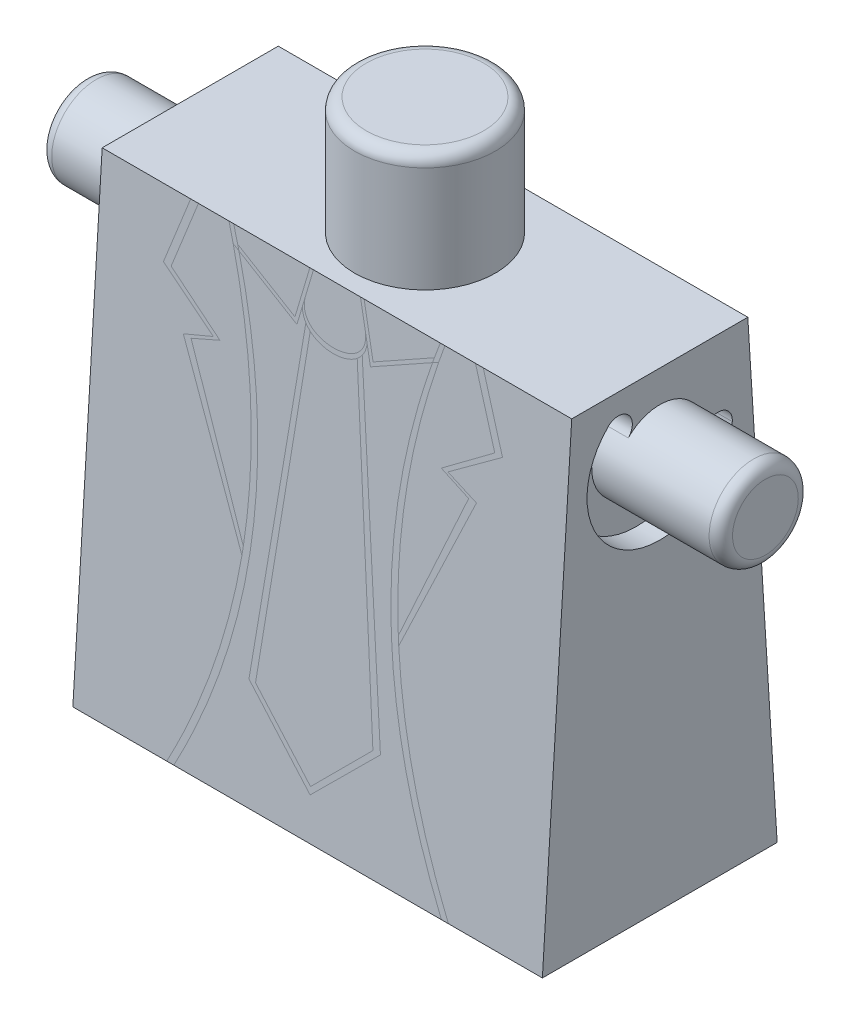
from build123d import *
from build123d.topology import SkipClean

# Parameters (mm, degrees)
SKETCH13_R                                  = 3
HEAD_PIN_DEPTH                              = 5
SKETCH2_W                                   = 6
SKETCH2_H                                   = 6
HIP_HOLE_PART_1_DEPTH                       = 2.5
SKETCH3_W                                   = 6
SKETCH3_H                                   = 6
HIP_HOLE_PART_2_DEPTH                       = 2.5
HIP_HOLE_PART_2_DRAFT                       = -10
SKETCH14_R                                  = 1.9
ARM_PIN_DEPTH                               = 4.5
ARM_START                                   = -1
ARM_POSITION_SLOT_DEPTH                     = 1
EASY_ARM_INSERT_R                           = 0.5
COPYING_OVER_ARM_AND_HIP_CONNECTORS_COPY_W  = 6
COPYING_OVER_ARM_AND_HIP_CONNECTORS_COPY_H  = 6
COPYING_OVER_ARM_AND_HIP_CONNECTORS_2_DEPTH = 2.5
COPYING_OVER_ARM_AND_HIP_CONNECTORS_2_DRAFT = -10
EASY_ARM_INSERT_OF_COPYING_OVER_ARM_AND_R   = 0.5
EASY_HEAD_INSERT_R                          = 0.5
SCALE1_SCALE                                = 2


with BuildPart() as part:
    # 3DSketch1 → Body section 0
    with BuildSketch(Plane(origin=(10, 20, -1.25), x_dir=(-0.9363291775690445, 0, -0.35112344158839165), z_dir=(0, -1, 0))):
        with BuildLine():
            Line((0, 0), (2.633425812, 7.022468832))
            Line((2.633425812, 7.022468832), (21.360009363, 0))
            Line((21.360009363, 0), (18.726583551, -7.022468832))
            Line((18.726583551, -7.022468832), (0, 0))
        make_face()
    # Sketch1 → Body section 1
    with BuildSketch(Plane(origin=(0, 0, 0), x_dir=(1, 0, 0), z_dir=(0, 1, 0))):
        with BuildLine():
            Line((-10, 0), (10, 0))
            Line((10, 0), (10, 10))
            Line((10, 10), (-10, 10))
            Line((-10, 10), (-10, 0))
        make_face()
    loft()

    # Sketch13 → Head pin (add)
    with BuildSketch(Plane(origin=(0, 20, 0), x_dir=(1, 0, 0), z_dir=(0, 1, 0))):
        with Locations(Location((0, 5, 0), (0, 0, 270))):
            Circle(SKETCH13_R)
    extrude(amount=HEAD_PIN_DEPTH)

    # Sketch2 → Hip hole part 1 (cut)
    with BuildSketch(Plane(origin=(0, 0, 0), x_dir=(-1, 0, 0), z_dir=(0, -1, 0))):
        with Locations((-5, 5)):
            Rectangle(SKETCH2_W, SKETCH2_H)
    hip_hole_part_1 = extrude(amount=-HIP_HOLE_PART_1_DEPTH, mode=Mode.SUBTRACT)


with BuildPart() as hip_hole_part_2_tool:
    # Sketch3 → Hip hole part 2 (with draft: the straight prism first)
    with BuildSketch(Plane.XZ.offset(-2.5)):
        with Locations((5, -5)):
            Rectangle(SKETCH3_W, SKETCH3_H)
    extrude(amount=-HIP_HOLE_PART_2_DEPTH)
    # Hip hole part 2: the draft: its side faces are tilted about the plane it starts from
    hip_hole_part_2_sides = [hip_hole_part_2_tool.faces().sort_by_distance(p)[0] for p in [
        (8, 3.75, -5),
        (5, 3.75, -2),
        (2, 3.75, -5),
        (5, 3.75, -8),
    ]]
    draft(hip_hole_part_2_sides, Plane.XZ.offset(-2.5), HIP_HOLE_PART_2_DRAFT)


with BuildPart() as part_1:
    add(part.part)

    # Hip hole part 2: cut by hip_hole_part_2_tool
    add(hip_hole_part_2_tool.part, mode=Mode.SUBTRACT)

    # Sketch18 → Weight reduction/Make it easy to add centerlines (revolve, cut)
    with BuildSketch(Plane(origin=(5, 5, -5), x_dir=(0, 0, -1), z_dir=(1, 0, 0))):
        Polygon((0, 0), (0, 2.901290929), (1.5, 2), (1.5, 0), align=None)
    weight_reduction_make_it_easy_to_add_cen = revolve(axis=Axis((5, -1.35, -5), (0, 1, 0)), mode=Mode.SUBTRACT)

    # Sketch14 → Arm pin (add)
    with BuildSketch(Plane(origin=(10, 0, 0), x_dir=(0, 0, -1), z_dir=(1, 0, 0))):
        with Locations(Location((5, 16.75, 0), (0, 0, 90))):
            Circle(SKETCH14_R)
    arm_pin = extrude(amount=ARM_PIN_DEPTH)

    # Sketch15 → Arm position slot (cut)
    with SkipClean():  # the faces are left unmerged after this step: merging them gives an invalid solid
        with BuildSketch(Plane(origin=(10, 0, 0), x_dir=(0, 0, -1), z_dir=(1, 0, 0)).offset(ARM_START)):
            with BuildLine():
                ThreePointArc((2.807968978, 18.942031022), (3.689883389, 13.94044586), (8.088203564, 16.479817197))
                ThreePointArc((8.088203564, 16.479817197), (7.542780191, 17.129827462), (6.892769926, 16.584404089))
                ThreePointArc((6.892769926, 16.584404089), (4.197025303, 15.028015205), (3.656497116, 18.093502884))
                ThreePointArc((3.656497116, 18.093502884), (3.656497116, 18.942031022), (2.807968978, 18.942031022))
            make_face()
        arm_position_slot = extrude(amount=ARM_POSITION_SLOT_DEPTH, mode=Mode.SUBTRACT)

    # Easy arm insert
    easy_arm_insert_edges = [part_1.edges().sort_by_distance(p)[0] for p in [
        (14.5, 14.85, -5),
    ]]
    fillet(easy_arm_insert_edges, radius=EASY_ARM_INSERT_R)

    # Copying over arm and hip connectors: Hip hole part 1, Weight reduction/Make it easy to add centerlines, Arm pin, Arm position slot across plane
    with SkipClean():  # the faces are left unmerged after this step: merging them gives an invalid solid
        add(hip_hole_part_1.mirror(Plane(origin=(0, 0, 0), x_dir=(0, 0, 1), z_dir=(1, 0, 0))), mode=Mode.SUBTRACT)
        add(weight_reduction_make_it_easy_to_add_cen.mirror(Plane(origin=(0, 0, 0), x_dir=(0, 0, 1), z_dir=(1, 0, 0))), mode=Mode.SUBTRACT)
        add(arm_pin.mirror(Plane(origin=(0, 0, 0), x_dir=(0, 0, 1), z_dir=(1, 0, 0))))
        add(arm_position_slot.mirror(Plane(origin=(0, 0, 0), x_dir=(0, 0, 1), z_dir=(1, 0, 0))), mode=Mode.SUBTRACT)


with BuildPart() as copying_over_arm_and_hip_connectors_2_tool:
    # Copying over arm and hip connectors copy → Copying over arm and hip connectors  2 (with draft: the straight prism first)
    with BuildSketch(Plane(origin=(0, 2.5, 0), x_dir=(-1, 0, 0), z_dir=(0, -1, 0))):
        with Locations((5, 5)):
            Rectangle(COPYING_OVER_ARM_AND_HIP_CONNECTORS_COPY_W, COPYING_OVER_ARM_AND_HIP_CONNECTORS_COPY_H)
    extrude(amount=-COPYING_OVER_ARM_AND_HIP_CONNECTORS_2_DEPTH)
    # Copying over arm and hip connectors  2: the draft: its side faces are tilted about the plane it starts from
    copying_over_arm_and_hip_connectors_2_sides = [copying_over_arm_and_hip_connectors_2_tool.faces().sort_by_distance(p)[0] for p in [
        (-8, 3.75, -5),
        (-5, 3.75, -2),
        (-2, 3.75, -5),
        (-5, 3.75, -8),
    ]]
    draft(copying_over_arm_and_hip_connectors_2_sides, Plane(origin=(0, 2.5, 0), x_dir=(-1, 0, 0), z_dir=(0, -1, 0)), COPYING_OVER_ARM_AND_HIP_CONNECTORS_2_DRAFT)


with BuildPart() as part_2:
    add(part_1.part)

    # Copying over arm and hip connectors  2: cut by copying_over_arm_and_hip_connectors_2_tool
    add(copying_over_arm_and_hip_connectors_2_tool.part, mode=Mode.SUBTRACT)

    # Easy arm insert of Copying over arm and
    easy_arm_insert_of_copying_over_arm_and_edges = [part_2.edges().sort_by_distance(p)[0] for p in [
        (-14.5, 14.85, -5),
    ]]
    fillet(easy_arm_insert_of_copying_over_arm_and_edges, radius=EASY_ARM_INSERT_OF_COPYING_OVER_ARM_AND_R)

    # Easy head insert
    easy_head_insert_edges = [part_2.edges().sort_by_distance(p)[0] for p in [
        (0, 25, -8),
    ]]
    fillet(easy_head_insert_edges, radius=EASY_HEAD_INSERT_R)


with BuildPart() as part_3:
    # Scale1: scaled about (2e-09, 10.984808506, -5.003313796)
    add(part_2.part.scale(SCALE1_SCALE).moved(Location((-2e-09, -10.984808506, 5.003313796))))


solid = part_3.part
